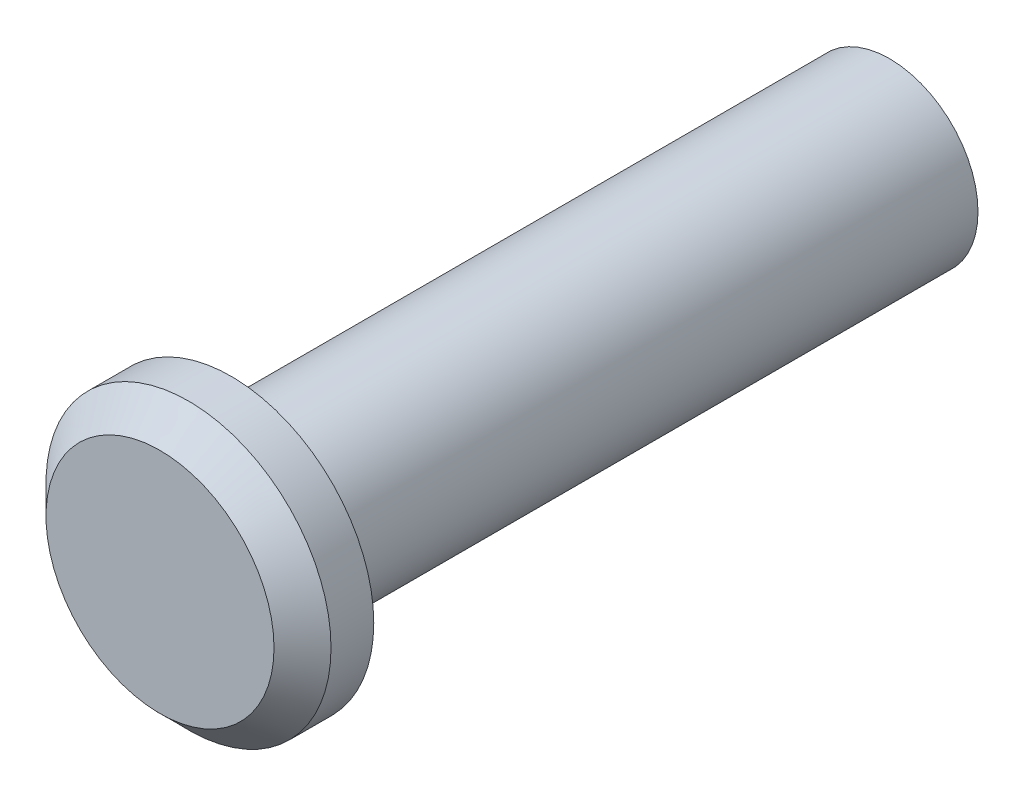
from build123d import *

# Parameters (mm, degrees)
SKETCH1_R           = 7.874
BOSS_EXTRUDE1_DEPTH = 65.024
SKETCH2_R           = 12.7
BOSS_EXTRUDE2_DEPTH = 6.35
CHAMFER1_SIZE       = 2.54


with BuildPart() as part:
    # Sketch1 → Boss-Extrude1 (new body)
    with BuildSketch(Plane.XY):
        Circle(SKETCH1_R)
    extrude(amount=-BOSS_EXTRUDE1_DEPTH)

    # Sketch2 → Boss-Extrude2 (add)
    with BuildSketch(Plane.XY):
        Circle(SKETCH2_R)
    extrude(amount=-BOSS_EXTRUDE2_DEPTH)

    # Chamfer1
    chamfer1_edges = [part.edges().sort_by_distance(p)[0] for p in [
        (-12.7, 0, 0),
    ]]
    chamfer(chamfer1_edges, length=CHAMFER1_SIZE)


solid = part.part
